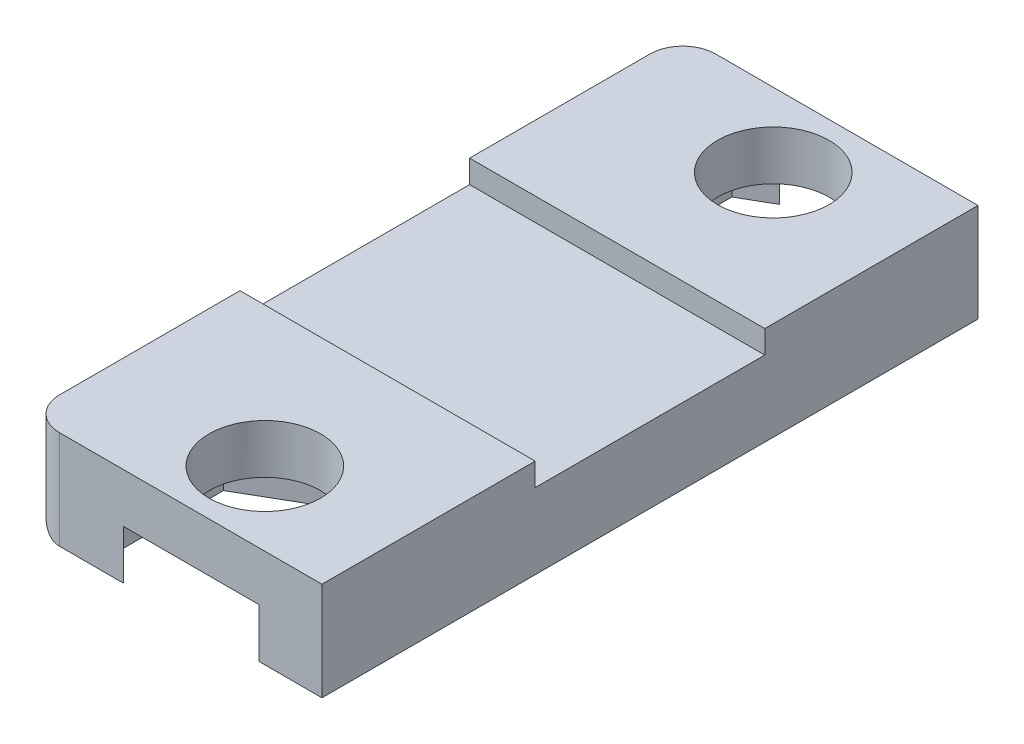
from build123d import *

# Parameters (mm, degrees)
CROQUIS1_W              = 9
CROQUIS1_H              = 20
CROQUIS1_R              = 1.7
SALIENTE_EXTRUIR1_DEPTH = 3
CORTAR_EXTRUIR2_DEPTH   = 1.5
CORTAR_EXTRUIR3_REACH   = 25.958
CROQUIS3_W              = 7
CROQUIS3_H              = 1
REDONDEO1_R             = 1
CROQUIS4_W              = 9
CROQUIS4_H              = 7
SALIENTE_EXTRUIR2_DEPTH = 0.3


with BuildPart() as part:
    # Croquis1 → Saliente-Extruir1 (new body)
    with BuildSketch(Plane(origin=(0, 0, 0), x_dir=(1, 0, 0), z_dir=(0, 1, 0))):
        with Locations((165.454426616, -12)):
            Rectangle(CROQUIS1_W, CROQUIS1_H)
        with Locations(Location((165.962302832, -4.25, 0), (0, 0, 270))):
            Circle(CROQUIS1_R, mode=Mode.SUBTRACT)
        with Locations(Location((165.962302832, -19.75, 0), (0, 0, 270))):
            Circle(CROQUIS1_R, mode=Mode.SUBTRACT)
    extrude(amount=-SALIENTE_EXTRUIR1_DEPTH)

    # Croquis2 → Cortar-Extruir2 (cut)
    with BuildSketch(Plane.XZ.offset(3)):
        Polygon((168.943819954, 21.471379713), (165.962302832, 23.192759426), (162.98078571, 21.471379713), (162.98078571, 18.028620287), (165.962302832, 16.307240574), (168.943819954, 18.028620287), align=None)
        Polygon((168.943819954, 5.971379713), (168.943819954, 2.528620287), (165.962302832, 0.807240574), (162.98078571, 2.528620287), (162.98078571, 5.971379713), (165.962302832, 7.692759426), align=None)
    extrude(amount=-CORTAR_EXTRUIR2_DEPTH, mode=Mode.SUBTRACT)

    # Croquis3 → Cortar-Extruir3 (cut, up to next)
    with BuildSketch(Plane.ZY.offset(-160.954426616), mode=Mode.PRIVATE) as cortar_extruir3_sk1:
        with Locations((12, -0.5)):
            Rectangle(CROQUIS3_W, CROQUIS3_H)
    cortar_extruir3_tool1 = extrude(cortar_extruir3_sk1.sketch, amount=-CORTAR_EXTRUIR3_REACH, mode=Mode.PRIVATE) & part.part
    add(cortar_extruir3_tool1.solids().sort_by_distance((160.954427, -0.5, 12))[0], mode=Mode.SUBTRACT)

    # Redondeo1
    redondeo1_edges = [part.edges().sort_by_distance(p)[0] for p in [
        (160.954426616, -3, 12),
        (160.954426616, -1.5, 2),
        (160.954426616, -1.5, 22),
    ]]
    fillet(redondeo1_edges, radius=REDONDEO1_R)

    # Croquis4 → Saliente-Extruir2 (add)
    with BuildSketch(Plane(origin=(0, -1, 0), x_dir=(1, 0, 0), z_dir=(0, 1, 0))):
        with Locations((165.454426616, -12)):
            Rectangle(CROQUIS4_W, CROQUIS4_H)
    extrude(amount=SALIENTE_EXTRUIR2_DEPTH)


solid = part.part
